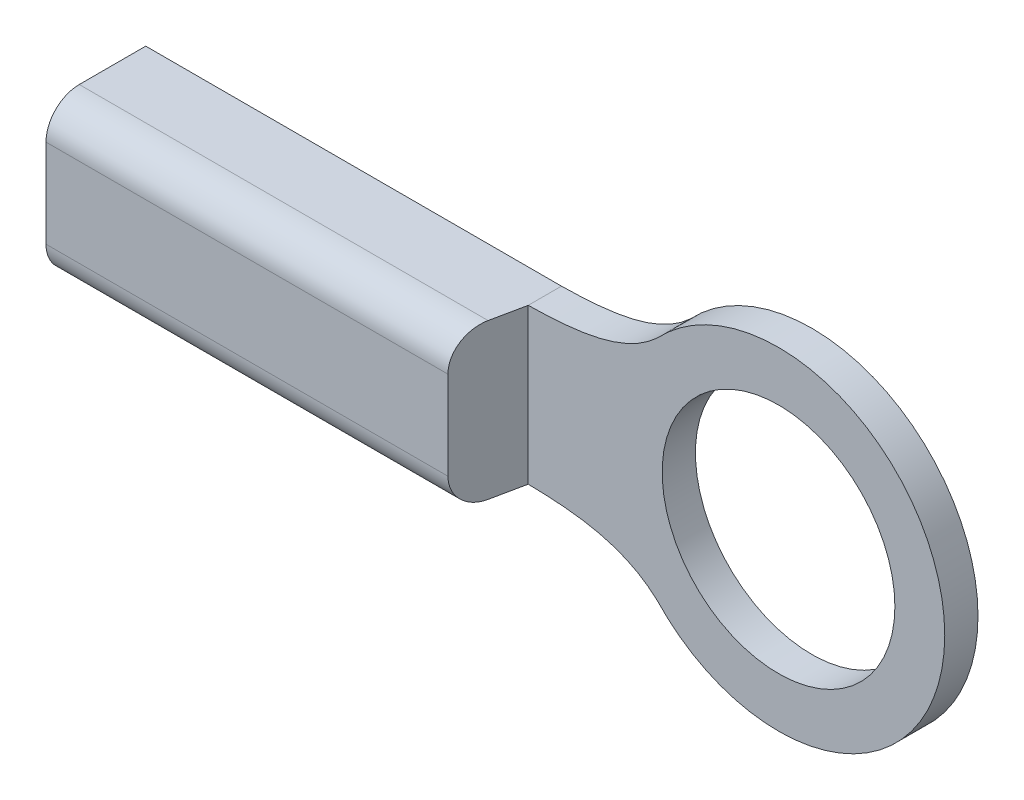
from build123d import *

# Parameters (mm, degrees)
SKETCH_1_R               = 2.5
SKETCH_1_R_2             = 1.75
EXTRUDE_1_DEPTH          = 0.5
EXTRUDE_2_DEPTH          = 1.5
CUT_EXTRUDE_1_DEPTH      = 11.432842359
CUT_EXTRUDE_1_DEPTH_BACK = 11.432842359
FILLET_1_R               = 0.5
SKETCH_4_R               = 0.557530811
CUT_EXTRUDE_2_DEPTH      = 0.1


with BuildPart() as part:
    # ｽｹｯﾁ1 → ﾎﾞｽ - 押し出し1 (new body)
    with BuildSketch(Plane.XY):
        Circle(SKETCH_1_R)
        Circle(SKETCH_1_R_2, mode=Mode.SUBTRACT)
    extrude(amount=EXTRUDE_1_DEPTH)

    # ｽｹｯﾁ2 → ﾎﾞｽ - 押し出し2 (add)
    with BuildSketch(Plane.XY):
        with BuildLine():
            add(Edge.make_bspline(
                [(-1.824229961, 1.709439981), (-2.341784399, 1.228330404), (-3.098510874, 1.179003243), (-3.764761935, 1.164839708)],
                knots=[0, 0, 0, 0, 1, 1, 1, 1], degree=3))
            Line((-3.764761935, 1.164839708), (-10.01719506, 1.164839708))
            Line((-10.01719506, 1.164839708), (-10.01719506, -1.164839708))
            Line((-10.01719506, -1.164839708), (-3.764761935, -1.164839708))
            add(Edge.make_bspline(
                [(-1.824229961, -1.709439981), (-2.341784399, -1.228330404), (-3.098510874, -1.179003243), (-3.764761935, -1.164839708)],
                knots=[0, 0, 0, 0, 1, 1, 1, 1], degree=3))
            ThreePointArc((-1.824229961, -1.709439981), (-2.324927408, -0.919082449), (-2.5, 0))
            ThreePointArc((-2.5, 0), (-2.324927408, 0.919082449), (-1.824229961, 1.709439981))
        make_face()
    extrude(amount=EXTRUDE_2_DEPTH)

    # ｽｹｯﾁ3 → ｶｯﾄ - 押し出し1 (cut, two sides: drawn at the far end of the back side and taken through both)
    with BuildSketch(Plane(origin=(0, 0, 0), x_dir=(1, 0, 0), z_dir=(0, 1, 0)).offset(-CUT_EXTRUDE_1_DEPTH_BACK)):
        Polygon((-3.986937401, -1.573225325), (-3.764761935, -0.5), (-1.824229961, -0.5), (-1.824229961, -1.921744076), (-3.986937401, -1.921744076), align=None)
    extrude(amount=CUT_EXTRUDE_1_DEPTH + CUT_EXTRUDE_1_DEPTH_BACK, mode=Mode.SUBTRACT)

    # ﾌｨﾚｯﾄ1
    fillet_1_edges = [part.edges().sort_by_distance(p)[0] for p in [
        (-6.994486802, -1.164839708, 1.5),
        (-6.994486802, 1.164839708, 1.5),
    ]]
    fillet(fillet_1_edges, radius=FILLET_1_R)

    # ｽｹｯﾁ4 → ｶｯﾄ - 押し出し2 (cut)
    with BuildSketch(Plane.ZY.offset(10.01719506)):
        with Locations((0.793196725, 0)):
            Circle(SKETCH_4_R)
    extrude(amount=-CUT_EXTRUDE_2_DEPTH, mode=Mode.SUBTRACT)


solid = part.part
